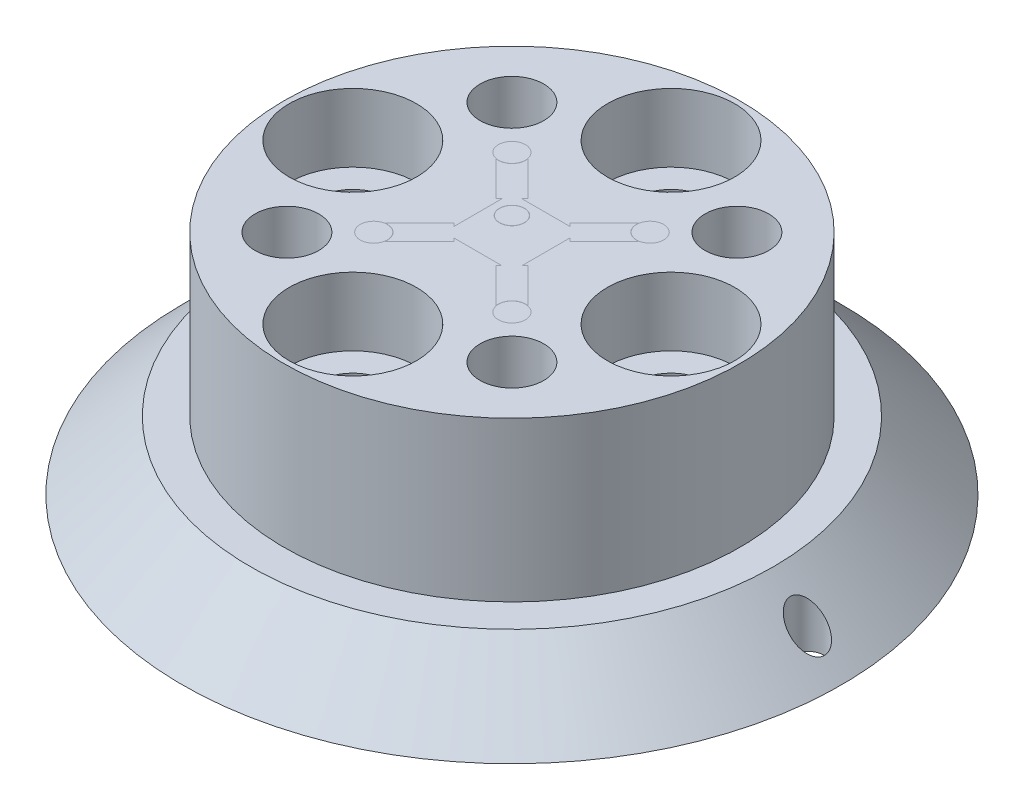
from build123d import *

# Parameters (mm, degrees)
SKETCH2_R                               = 1.4
CUT_EXTRUDE1_DEPTH                      = 23.814469093
CBORE_FOR_M5_HEX_HEAD_BOLT1_D           = 3.2
CBORE_FOR_M5_HEX_HEAD_BOLT1_CBORE_D     = 5.6
CBORE_FOR_M5_HEX_HEAD_BOLT1_CBORE_DEPTH = 3
SKETCH4_R                               = 0.75
CUT_EXTRUDE3_DEPTH                      = 23.814469093
GL_END_BLUE_CUT_START                   = 9.4
GL_END_BLUE_CUT_DEPTH                   = 1.1
GL_END_BLUE_INLAY_START                 = 9.4
GL_END_BLUE_INLAY_DEPTH                 = 0.6
GL_END_WHITE_CUT_START                  = 9.4
GL_END_WHITE_CUT_DEPTH                  = 1.1
GL_END_WHITE_INLAY_START                = 9.4
GL_END_WHITE_INLAY_DEPTH                = 0.6
GL_END_WHITE_INLAY_2_DEPTH              = 0.6
GL_END_WHITE_INLAY_3_DEPTH              = 0.6
GL_END_WHITE_INLAY_4_DEPTH              = 0.6
GL_END_WHITE_INLAY_5_DEPTH              = 0.6


with BuildPart() as part:
    # Sketch1 → Revolve1 (revolve)
    with BuildSketch(Plane.XY):
        Polygon((14.5, 0), (11.5, 3), (10.025, 3), (10.025, 10), (0, 10), (0, 0), align=None)
    revolve(axis=Axis((0, 10, 0), (0, -1, 0)))

    # Sketch2 → Cut-Extrude1 (cut, through all)
    with BuildSketch(Plane(origin=(0, 10, 0), x_dir=(1, 0, 0), z_dir=(0, 1, 0))):
        with Locations((0, 7)):
            Circle(SKETCH2_R)
        with Locations((4.949747468, 4.949747468)):
            Circle(SKETCH2_R)
        with Locations((7, 0)):
            Circle(SKETCH2_R)
        with Locations((4.949747468, -4.949747468)):
            Circle(SKETCH2_R)
        with Locations((0, -7)):
            Circle(SKETCH2_R)
        with Locations((-4.949747468, -4.949747468)):
            Circle(SKETCH2_R)
        with Locations((-7, 0)):
            Circle(SKETCH2_R)
        with Locations((-4.949747468, 4.949747468)):
            Circle(SKETCH2_R)
    extrude(amount=-CUT_EXTRUDE1_DEPTH, mode=Mode.SUBTRACT)

    # CBORE for M5 Hex Head Bolt1 (through all)
    with Locations(Plane(origin=(0, 10, -7), x_dir=(1, 0, 0), z_dir=(0, 1, 0))):
        with Locations((0, 0), (-7, -7), (0, -14), (7, -7)):
            CounterBoreHole(CBORE_FOR_M5_HEX_HEAD_BOLT1_D / 2, CBORE_FOR_M5_HEX_HEAD_BOLT1_CBORE_D / 2, CBORE_FOR_M5_HEX_HEAD_BOLT1_CBORE_DEPTH)

    # Sketch4 → Cut-Extrude3 (cut, through all)
    with BuildSketch(Plane(origin=(0, 0, 0), x_dir=(1, 0, 0), z_dir=(0, 1, 0))):
        with Locations((13, 0)):
            Circle(SKETCH4_R)
    extrude(amount=CUT_EXTRUDE3_DEPTH, mode=Mode.SUBTRACT)

    # GL_end_blue → GL_end_blue_cut (cut)
    with BuildSketch(Plane(origin=(0, 0, 0), x_dir=(1, 0, 0), z_dir=(0, 1, 0)).offset(GL_END_BLUE_CUT_START)):
        Polygon((-0.926309883, -1.626345597), (-2.44622922, -3.146264933), (-2.435521797, -3.040442214), (-2.461557902, -2.864921048), (-2.537421115, -2.704521762), (-2.612821263, -2.612646415), (-2.755237951, -2.507023), (-2.865044684, -2.461539563), (-3.040442214, -2.435521797), (-3.146264933, -2.44622922), (-1.626345597, -0.926309883), (-1.495, -1.05765548), (-1.495, 1.05765548), (-1.626345597, 0.926309883), (-3.146264933, 2.44622922), (-3.040442214, 2.435521797), (-2.864921048, 2.461557902), (-2.704521762, 2.537421115), (-2.612646415, 2.612821263), (-2.507023, 2.755237951), (-2.461539563, 2.865044684), (-2.435521797, 3.040442214), (-2.44622922, 3.146264933), (-0.926309883, 1.626345597), (-1.05765548, 1.495), (1.05765548, 1.495), (0.926309883, 1.626345597), (2.44622922, 3.146264933), (2.435521797, 3.040442214), (2.461557902, 2.864921048), (2.537421115, 2.704521762), (2.61274245, 2.61274245), (2.704521762, 2.537421115), (2.864921048, 2.461557902), (3.040442214, 2.435521797), (3.146264933, 2.44622922), (1.626345597, 0.926309883), (1.495, 1.05765548), (1.495, -1.05765548), (1.626345597, -0.926309883), (3.146264933, -2.44622922), (3.040442214, -2.435521797), (2.865044684, -2.461539563), (2.755237951, -2.507023), (2.612821263, -2.612646415), (2.537421115, -2.704521762), (2.461557902, -2.864921048), (2.435521797, -3.040442214), (2.44622922, -3.146264933), (0.926309883, -1.626345597), (1.05765548, -1.495), (-1.05765548, -1.495), align=None)
        Polygon((-0.084044503, 0.581994219), (-0.084044503, 0.690797987), (-0.105271066, 0.797511122), (-0.146908465, 0.898032696), (-0.2073566, 0.988499724), (-0.284292483, 1.065435606), (-0.37475951, 1.125883741), (-0.475281084, 1.167521141), (-0.581994219, 1.188747703), (-0.690797987, 1.188747703), (-0.797511122, 1.167521141), (-0.898032696, 1.125883741), (-0.988499724, 1.065435606), (-1.065435606, 0.988499724), (-1.125883741, 0.898032696), (-1.167521141, 0.797511122), (-1.188747703, 0.690797987), (-1.188747703, 0.581994219), (-1.167521141, 0.475281084), (-1.125883741, 0.37475951), (-1.065435606, 0.284292483), (-0.988499724, 0.2073566), (-0.898032696, 0.146908465), (-0.797511122, 0.105271066), (-0.690797987, 0.084044503), (-0.581994219, 0.084044503), (-0.475281084, 0.105271066), (-0.37475951, 0.146908465), (-0.284292483, 0.2073566), (-0.2073566, 0.284292483), (-0.146908465, 0.37475951), (-0.105271066, 0.475281084), align=None, mode=Mode.SUBTRACT)
    extrude(amount=GL_END_BLUE_CUT_DEPTH, mode=Mode.SUBTRACT)

    # GL_end_white → GL_end_white_cut (cut)
    with BuildSketch(Plane(origin=(0, 0, 0), x_dir=(1, 0, 0), z_dir=(0, 1, 0)).offset(GL_END_WHITE_CUT_START)):
        Polygon((3.535263463, -3.371110007), (3.461270587, -3.461270587), (3.371110007, -3.535263463), (3.268246543, -3.59024513), (3.156633181, -3.624102673), (3.040559159, -3.635534966), (2.924485137, -3.624102673), (2.812871775, -3.59024513), (2.710008311, -3.535263463), (2.619847731, -3.461270587), (2.545854855, -3.371110007), (2.490873189, -3.268246543), (2.457015645, -3.156633181), (2.445583352, -3.040559159), (2.457015645, -2.924485137), (2.490873189, -2.812871775), (2.545854855, -2.710008311), (2.619847731, -2.619847731), (2.710008311, -2.545854855), (2.812871775, -2.490873189), (2.924485137, -2.457015645), (3.040559159, -2.445583352), (3.156633181, -2.457015645), (3.268246543, -2.490873189), (3.371110007, -2.545854855), (3.461270587, -2.619847731), (3.535263463, -2.710008311), (3.59024513, -2.812871775), (3.624102673, -2.924485137), (3.635534966, -3.040559159), (3.624102673, -3.156633181), (3.59024513, -3.268246543), align=None)
        Polygon((-2.545854855, -3.371110007), (-2.619847731, -3.461270587), (-2.710008311, -3.535263463), (-2.812871775, -3.59024513), (-2.924485137, -3.624102673), (-3.040559159, -3.635534966), (-3.156633181, -3.624102673), (-3.268246543, -3.59024513), (-3.371110007, -3.535263463), (-3.461270587, -3.461270587), (-3.535263463, -3.371110007), (-3.59024513, -3.268246543), (-3.624102673, -3.156633181), (-3.635534966, -3.040559159), (-3.624102673, -2.924485137), (-3.59024513, -2.812871775), (-3.535263463, -2.710008311), (-3.461270587, -2.619847731), (-3.371110007, -2.545854855), (-3.268246543, -2.490873189), (-3.156633181, -2.457015645), (-3.040559159, -2.445583352), (-2.924485137, -2.457015645), (-2.812871775, -2.490873189), (-2.710008311, -2.545854855), (-2.619847731, -2.619847731), (-2.545854855, -2.710008311), (-2.490873189, -2.812871775), (-2.457015645, -2.924485137), (-2.445583352, -3.040559159), (-2.457015645, -3.156633181), (-2.490873189, -3.268246543), align=None)
        Polygon((-0.18326528, 0.333623767), (-0.251040014, 0.251040014), (-0.333623767, 0.18326528), (-0.427842891, 0.132904109), (-0.530076597, 0.101891853), (-0.636396103, 0.091420296), (-0.742715609, 0.101891853), (-0.844949315, 0.132904109), (-0.939168439, 0.18326528), (-1.021752192, 0.251040014), (-1.089526926, 0.333623767), (-1.139888097, 0.427842891), (-1.170900353, 0.530076597), (-1.18137191, 0.636396103), (-1.170900353, 0.742715609), (-1.139888097, 0.844949315), (-1.089526926, 0.939168439), (-1.021752192, 1.021752192), (-0.939168439, 1.089526926), (-0.844949315, 1.139888097), (-0.742715609, 1.170900353), (-0.636396103, 1.18137191), (-0.530076597, 1.170900353), (-0.427842891, 1.139888097), (-0.333623767, 1.089526926), (-0.251040014, 1.021752192), (-0.18326528, 0.939168439), (-0.132904109, 0.844949315), (-0.101891853, 0.742715609), (-0.091420296, 0.636396103), (-0.101891853, 0.530076597), (-0.132904109, 0.427842891), align=None)
        Polygon((-2.619847731, 2.619847731), (-2.710008311, 2.545854855), (-2.812871775, 2.490873189), (-2.924485137, 2.457015645), (-3.040559159, 2.445583352), (-3.156633181, 2.457015645), (-3.268246543, 2.490873189), (-3.371110007, 2.545854855), (-3.461270587, 2.619847731), (-3.535263463, 2.710008311), (-3.59024513, 2.812871775), (-3.624102673, 2.924485137), (-3.635534966, 3.040559159), (-3.624102673, 3.156633181), (-3.59024513, 3.268246543), (-3.535263463, 3.371110007), (-3.461270587, 3.461270587), (-3.371110007, 3.535263463), (-3.268246543, 3.59024513), (-3.156633181, 3.624102673), (-3.040559159, 3.635534966), (-2.924485137, 3.624102673), (-2.812871775, 3.59024513), (-2.710008311, 3.535263463), (-2.619847731, 3.461270587), (-2.545854855, 3.371110007), (-2.490873189, 3.268246543), (-2.457015645, 3.156633181), (-2.445583352, 3.040559159), (-2.457015645, 2.924485137), (-2.490873189, 2.812871775), (-2.545854855, 2.710008311), align=None)
        Polygon((3.461270587, 2.619847731), (3.371110007, 2.545854855), (3.268246543, 2.490873189), (3.156633181, 2.457015645), (3.040559159, 2.445583352), (2.924485137, 2.457015645), (2.812871775, 2.490873189), (2.710008311, 2.545854855), (2.619847731, 2.619847731), (2.545854855, 2.710008311), (2.490873189, 2.812871775), (2.457015645, 2.924485137), (2.445583352, 3.040559159), (2.457015645, 3.156633181), (2.490873189, 3.268246543), (2.545854855, 3.371110007), (2.619847731, 3.461270587), (2.710008311, 3.535263463), (2.812871775, 3.59024513), (2.924485137, 3.624102673), (3.040559159, 3.635534966), (3.156633181, 3.624102673), (3.268246543, 3.59024513), (3.371110007, 3.535263463), (3.461270587, 3.461270587), (3.535263463, 3.371110007), (3.59024513, 3.268246543), (3.624102673, 3.156633181), (3.635534966, 3.040559159), (3.624102673, 2.924485137), (3.59024513, 2.812871775), (3.535263463, 2.710008311), align=None)
    extrude(amount=GL_END_WHITE_CUT_DEPTH, mode=Mode.SUBTRACT)


with BuildPart() as body_2:
    # GL_end_blue<2> → GL_end_blue_inlay (new body)
    with BuildSketch(Plane(origin=(0, 0, 0), x_dir=(1, 0, 0), z_dir=(0, 1, 0)).offset(GL_END_BLUE_INLAY_START)):
        Polygon((-0.926309883, -1.626345597), (-2.44622922, -3.146264933), (-2.435521797, -3.040442214), (-2.461557902, -2.864921048), (-2.537421115, -2.704521762), (-2.612821263, -2.612646415), (-2.755237951, -2.507023), (-2.865044684, -2.461539563), (-3.040442214, -2.435521797), (-3.146264933, -2.44622922), (-1.626345597, -0.926309883), (-1.495, -1.05765548), (-1.495, 1.05765548), (-1.626345597, 0.926309883), (-3.146264933, 2.44622922), (-3.040442214, 2.435521797), (-2.864921048, 2.461557902), (-2.704521762, 2.537421115), (-2.612646415, 2.612821263), (-2.507023, 2.755237951), (-2.461539563, 2.865044684), (-2.435521797, 3.040442214), (-2.44622922, 3.146264933), (-0.926309883, 1.626345597), (-1.05765548, 1.495), (1.05765548, 1.495), (0.926309883, 1.626345597), (2.44622922, 3.146264933), (2.435521797, 3.040442214), (2.461557902, 2.864921048), (2.537421115, 2.704521762), (2.61274245, 2.61274245), (2.704521762, 2.537421115), (2.864921048, 2.461557902), (3.040442214, 2.435521797), (3.146264933, 2.44622922), (1.626345597, 0.926309883), (1.495, 1.05765548), (1.495, -1.05765548), (1.626345597, -0.926309883), (3.146264933, -2.44622922), (3.040442214, -2.435521797), (2.865044684, -2.461539563), (2.755237951, -2.507023), (2.612821263, -2.612646415), (2.537421115, -2.704521762), (2.461557902, -2.864921048), (2.435521797, -3.040442214), (2.44622922, -3.146264933), (0.926309883, -1.626345597), (1.05765548, -1.495), (-1.05765548, -1.495), align=None)
        Polygon((-0.084044503, 0.581994219), (-0.084044503, 0.690797987), (-0.105271066, 0.797511122), (-0.146908465, 0.898032696), (-0.2073566, 0.988499724), (-0.284292483, 1.065435606), (-0.37475951, 1.125883741), (-0.475281084, 1.167521141), (-0.581994219, 1.188747703), (-0.690797987, 1.188747703), (-0.797511122, 1.167521141), (-0.898032696, 1.125883741), (-0.988499724, 1.065435606), (-1.065435606, 0.988499724), (-1.125883741, 0.898032696), (-1.167521141, 0.797511122), (-1.188747703, 0.690797987), (-1.188747703, 0.581994219), (-1.167521141, 0.475281084), (-1.125883741, 0.37475951), (-1.065435606, 0.284292483), (-0.988499724, 0.2073566), (-0.898032696, 0.146908465), (-0.797511122, 0.105271066), (-0.690797987, 0.084044503), (-0.581994219, 0.084044503), (-0.475281084, 0.105271066), (-0.37475951, 0.146908465), (-0.284292483, 0.2073566), (-0.2073566, 0.284292483), (-0.146908465, 0.37475951), (-0.105271066, 0.475281084), align=None, mode=Mode.SUBTRACT)
    extrude(amount=GL_END_BLUE_INLAY_DEPTH)


with BuildPart() as body_3:
    # GL_end_white<2> → GL_end_white_inlay (new body)
    with BuildSketch(Plane(origin=(0, 0, 0), x_dir=(1, 0, 0), z_dir=(0, 1, 0)).offset(GL_END_WHITE_INLAY_START)):
        Polygon((3.535263463, -3.371110007), (3.461270587, -3.461270587), (3.371110007, -3.535263463), (3.268246543, -3.59024513), (3.156633181, -3.624102673), (3.040559159, -3.635534966), (2.924485137, -3.624102673), (2.812871775, -3.59024513), (2.710008311, -3.535263463), (2.619847731, -3.461270587), (2.545854855, -3.371110007), (2.490873189, -3.268246543), (2.457015645, -3.156633181), (2.445583352, -3.040559159), (2.457015645, -2.924485137), (2.490873189, -2.812871775), (2.545854855, -2.710008311), (2.619847731, -2.619847731), (2.710008311, -2.545854855), (2.812871775, -2.490873189), (2.924485137, -2.457015645), (3.040559159, -2.445583352), (3.156633181, -2.457015645), (3.268246543, -2.490873189), (3.371110007, -2.545854855), (3.461270587, -2.619847731), (3.535263463, -2.710008311), (3.59024513, -2.812871775), (3.624102673, -2.924485137), (3.635534966, -3.040559159), (3.624102673, -3.156633181), (3.59024513, -3.268246543), align=None)
    extrude(amount=GL_END_WHITE_INLAY_DEPTH)


with BuildPart() as body_4:
    # GL_end_white<2> → GL_end_white_inlay 2 (new body)
    with BuildSketch(Plane(origin=(0, 0, 0), x_dir=(1, 0, 0), z_dir=(0, 1, 0)).offset(GL_END_WHITE_INLAY_START)):
        Polygon((-2.545854855, -3.371110007), (-2.619847731, -3.461270587), (-2.710008311, -3.535263463), (-2.812871775, -3.59024513), (-2.924485137, -3.624102673), (-3.040559159, -3.635534966), (-3.156633181, -3.624102673), (-3.268246543, -3.59024513), (-3.371110007, -3.535263463), (-3.461270587, -3.461270587), (-3.535263463, -3.371110007), (-3.59024513, -3.268246543), (-3.624102673, -3.156633181), (-3.635534966, -3.040559159), (-3.624102673, -2.924485137), (-3.59024513, -2.812871775), (-3.535263463, -2.710008311), (-3.461270587, -2.619847731), (-3.371110007, -2.545854855), (-3.268246543, -2.490873189), (-3.156633181, -2.457015645), (-3.040559159, -2.445583352), (-2.924485137, -2.457015645), (-2.812871775, -2.490873189), (-2.710008311, -2.545854855), (-2.619847731, -2.619847731), (-2.545854855, -2.710008311), (-2.490873189, -2.812871775), (-2.457015645, -2.924485137), (-2.445583352, -3.040559159), (-2.457015645, -3.156633181), (-2.490873189, -3.268246543), align=None)
    extrude(amount=GL_END_WHITE_INLAY_2_DEPTH)


with BuildPart() as body_5:
    # GL_end_white<2> → GL_end_white_inlay 3 (new body)
    with BuildSketch(Plane(origin=(0, 0, 0), x_dir=(1, 0, 0), z_dir=(0, 1, 0)).offset(GL_END_WHITE_INLAY_START)):
        Polygon((-0.18326528, 0.333623767), (-0.251040014, 0.251040014), (-0.333623767, 0.18326528), (-0.427842891, 0.132904109), (-0.530076597, 0.101891853), (-0.636396103, 0.091420296), (-0.742715609, 0.101891853), (-0.844949315, 0.132904109), (-0.939168439, 0.18326528), (-1.021752192, 0.251040014), (-1.089526926, 0.333623767), (-1.139888097, 0.427842891), (-1.170900353, 0.530076597), (-1.18137191, 0.636396103), (-1.170900353, 0.742715609), (-1.139888097, 0.844949315), (-1.089526926, 0.939168439), (-1.021752192, 1.021752192), (-0.939168439, 1.089526926), (-0.844949315, 1.139888097), (-0.742715609, 1.170900353), (-0.636396103, 1.18137191), (-0.530076597, 1.170900353), (-0.427842891, 1.139888097), (-0.333623767, 1.089526926), (-0.251040014, 1.021752192), (-0.18326528, 0.939168439), (-0.132904109, 0.844949315), (-0.101891853, 0.742715609), (-0.091420296, 0.636396103), (-0.101891853, 0.530076597), (-0.132904109, 0.427842891), align=None)
    extrude(amount=GL_END_WHITE_INLAY_3_DEPTH)


with BuildPart() as body_6:
    # GL_end_white<2> → GL_end_white_inlay 4 (new body)
    with BuildSketch(Plane(origin=(0, 0, 0), x_dir=(1, 0, 0), z_dir=(0, 1, 0)).offset(GL_END_WHITE_INLAY_START)):
        Polygon((-2.619847731, 2.619847731), (-2.710008311, 2.545854855), (-2.812871775, 2.490873189), (-2.924485137, 2.457015645), (-3.040559159, 2.445583352), (-3.156633181, 2.457015645), (-3.268246543, 2.490873189), (-3.371110007, 2.545854855), (-3.461270587, 2.619847731), (-3.535263463, 2.710008311), (-3.59024513, 2.812871775), (-3.624102673, 2.924485137), (-3.635534966, 3.040559159), (-3.624102673, 3.156633181), (-3.59024513, 3.268246543), (-3.535263463, 3.371110007), (-3.461270587, 3.461270587), (-3.371110007, 3.535263463), (-3.268246543, 3.59024513), (-3.156633181, 3.624102673), (-3.040559159, 3.635534966), (-2.924485137, 3.624102673), (-2.812871775, 3.59024513), (-2.710008311, 3.535263463), (-2.619847731, 3.461270587), (-2.545854855, 3.371110007), (-2.490873189, 3.268246543), (-2.457015645, 3.156633181), (-2.445583352, 3.040559159), (-2.457015645, 2.924485137), (-2.490873189, 2.812871775), (-2.545854855, 2.710008311), align=None)
    extrude(amount=GL_END_WHITE_INLAY_4_DEPTH)


with BuildPart() as body_7:
    # GL_end_white<2> → GL_end_white_inlay 5 (new body)
    with BuildSketch(Plane(origin=(0, 0, 0), x_dir=(1, 0, 0), z_dir=(0, 1, 0)).offset(GL_END_WHITE_INLAY_START)):
        Polygon((3.461270587, 2.619847731), (3.371110007, 2.545854855), (3.268246543, 2.490873189), (3.156633181, 2.457015645), (3.040559159, 2.445583352), (2.924485137, 2.457015645), (2.812871775, 2.490873189), (2.710008311, 2.545854855), (2.619847731, 2.619847731), (2.545854855, 2.710008311), (2.490873189, 2.812871775), (2.457015645, 2.924485137), (2.445583352, 3.040559159), (2.457015645, 3.156633181), (2.490873189, 3.268246543), (2.545854855, 3.371110007), (2.619847731, 3.461270587), (2.710008311, 3.535263463), (2.812871775, 3.59024513), (2.924485137, 3.624102673), (3.040559159, 3.635534966), (3.156633181, 3.624102673), (3.268246543, 3.59024513), (3.371110007, 3.535263463), (3.461270587, 3.461270587), (3.535263463, 3.371110007), (3.59024513, 3.268246543), (3.624102673, 3.156633181), (3.635534966, 3.040559159), (3.624102673, 2.924485137), (3.59024513, 2.812871775), (3.535263463, 2.710008311), align=None)
    extrude(amount=GL_END_WHITE_INLAY_5_DEPTH)


solid = Compound([part.part, body_2.part, body_3.part, body_4.part, body_5.part, body_6.part, body_7.part])
